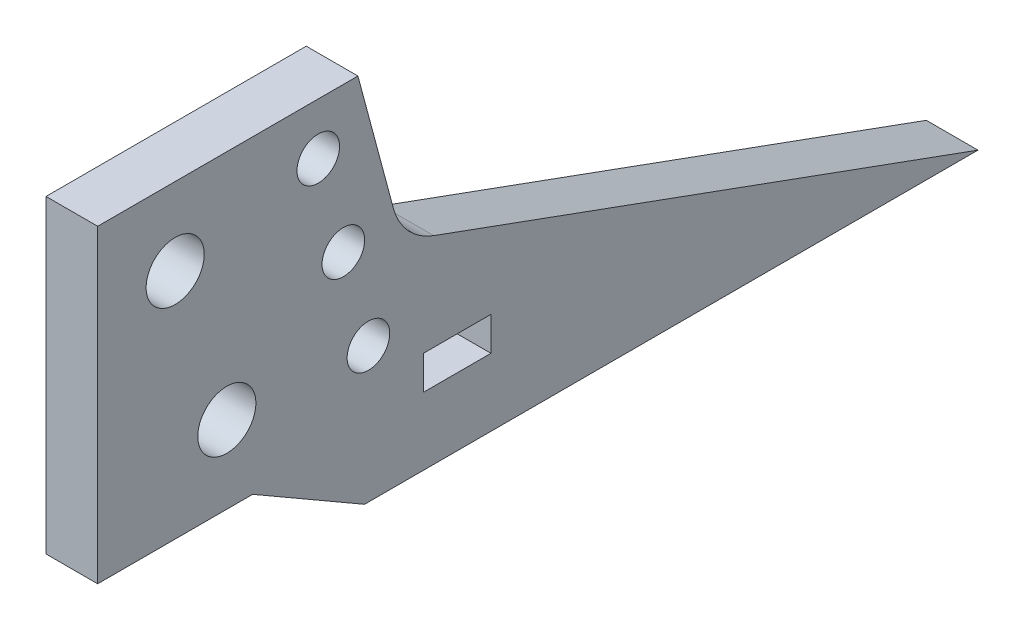
from build123d import *

# Parameters (mm, degrees)
RESSALTO_EXTRUS_O1_DEPTH = 8
ESBO_O2_W                = 32.3
ESBO_O2_H                = 16.047818473
CORTE_EXTRUS_O1_DEPTH    = 149.344709352
ESBO_O3_W                = 8
ESBO_O3_H                = 47.952181527
RESSALTO_EXTRUS_O2_DEPTH = 8
FURO_COM_FOLGA_DE_M81_D  = 9
FURO_COM_FOLGA_DE_M61_D  = 6.6
FILETE1_R                = 10
ESBO_O9_W                = 10.453941956
ESBO_O9_H                = 5.226970978
CORTE_EXTRUS_O2_DEPTH    = 142.026976627


with BuildPart() as part:
    # Esboço1 → Ressalto-extrusão1 (new body)
    with BuildSketch(Plane(origin=(0, 0, 0), x_dir=(0, 0, -1), z_dir=(1, 0, 0))):
        Polygon((28, 74), (39.129876604, 32.462735031), (128.320508076, 0), (33.320508076, 0), (16, 10), (0, 10), (0, 74), align=None)
    extrude(amount=RESSALTO_EXTRUS_O1_DEPTH)

    # Esboço2 → Corte-extrusão1 (cut, through all)
    with BuildSketch(Plane(origin=(8, 0, 0), x_dir=(0, 0, -1), z_dir=(1, 0, 0))):
        with Locations((16.15, 65.976090763)):
            Rectangle(ESBO_O2_W, ESBO_O2_H)
    extrude(amount=-CORTE_EXTRUS_O1_DEPTH, mode=Mode.SUBTRACT)

    # Esboço3 → Ressalto-extrusão2 (add)
    with BuildSketch(Plane(origin=(8, 0, 0), x_dir=(0, 0, -1), z_dir=(1, 0, 0))):
        with Locations((-4, 33.976090763)):
            Rectangle(ESBO_O3_W, ESBO_O3_H)
    extrude(amount=-RESSALTO_EXTRUS_O2_DEPTH)

    # Furo com folga de M81 (through all)
    with Locations(Plane.ZY):
        with Locations((-4, 45.952181527), (-12, 22)):
            Hole(FURO_COM_FOLGA_DE_M81_D / 2)

    # Furo com folga de M61 (through all)
    with Locations(Plane(origin=(8, 0, 0), x_dir=(0, 0, -1), z_dir=(1, 0, 0))):
        with Locations((26.161384096, 49.952181527), (30.043669773, 35.463294133), (33.925955449, 20.974406739)):
            Hole(FURO_COM_FOLGA_DE_M61_D / 2)

    # Filete1
    filete1_edges = [part.edges().sort_by_distance(p)[0] for p in [
        (4, 32.462735031, -39.129876604),
    ]]
    fillet(filete1_edges, radius=FILETE1_R)

    # Esboço9 → Corte-extrusão2 (cut, through all)
    with BuildSketch(Plane(origin=(8, 0, 0), x_dir=(0, 0, -1), z_dir=(1, 0, 0))):
        with Locations((47.673601146, 13.077387372)):
            Rectangle(ESBO_O9_W, ESBO_O9_H)
    extrude(amount=-CORTE_EXTRUS_O2_DEPTH, mode=Mode.SUBTRACT)


solid = part.part
